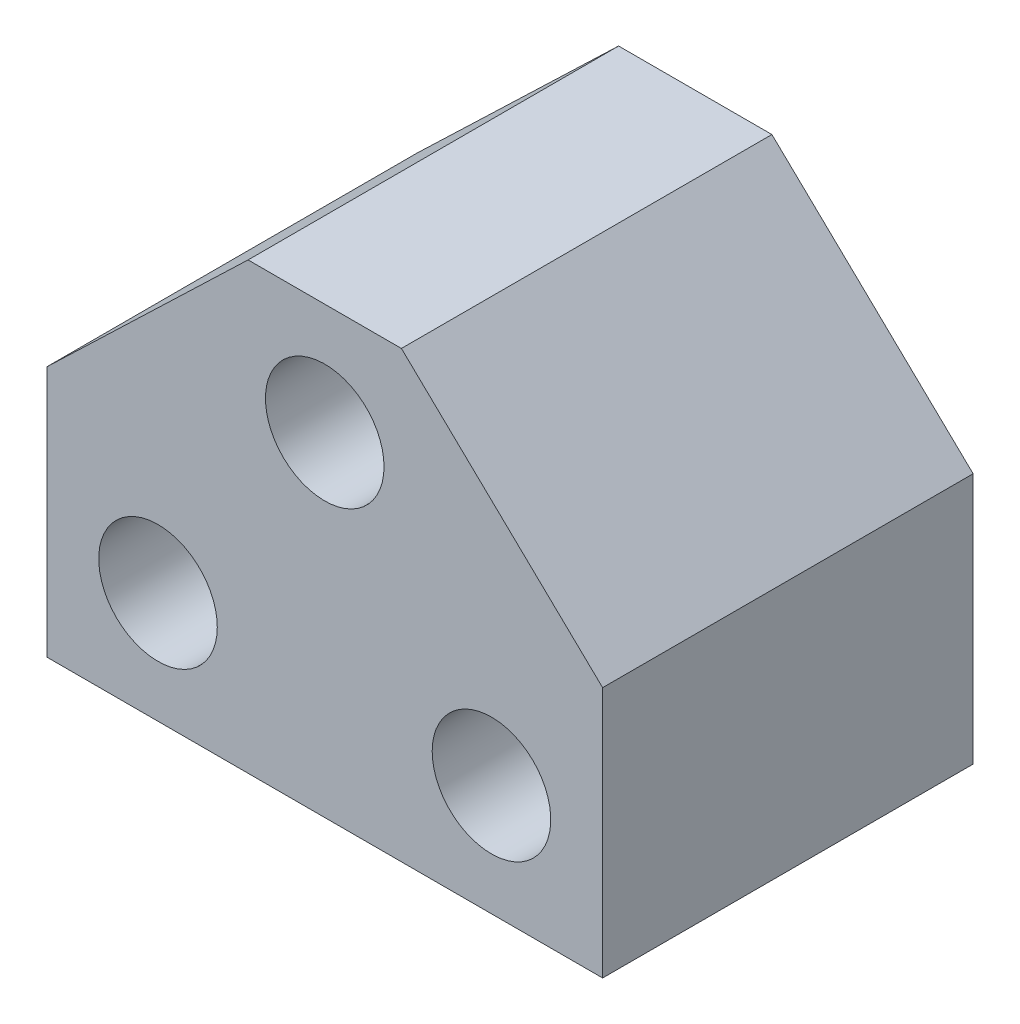
from build123d import *

# Parameters (mm, degrees)
SKETCH1_R           = 1.6
BOSS_EXTRUDE1_DEPTH = 10


with BuildPart() as part:
    # Sketch1 → Boss-Extrude1 (new body)
    with BuildSketch(Plane.XY):
        Polygon((7.5, 0), (-7.5, 0), (-7.5, 6), (-7.5, 6.78663835), (-2.068965517, 12), (2.068965517, 12), (7.5, 6.78663835), (7.5, 6), align=None)
        with Locations((0, 9)):
            Circle(SKETCH1_R, mode=Mode.SUBTRACT)
        with Locations((-4.5, 3)):
            Circle(SKETCH1_R, mode=Mode.SUBTRACT)
        with Locations(Location((4.5, 3, 0), (0, 0, 180))):
            Circle(SKETCH1_R, mode=Mode.SUBTRACT)
    extrude(amount=BOSS_EXTRUDE1_DEPTH)


solid = part.part
